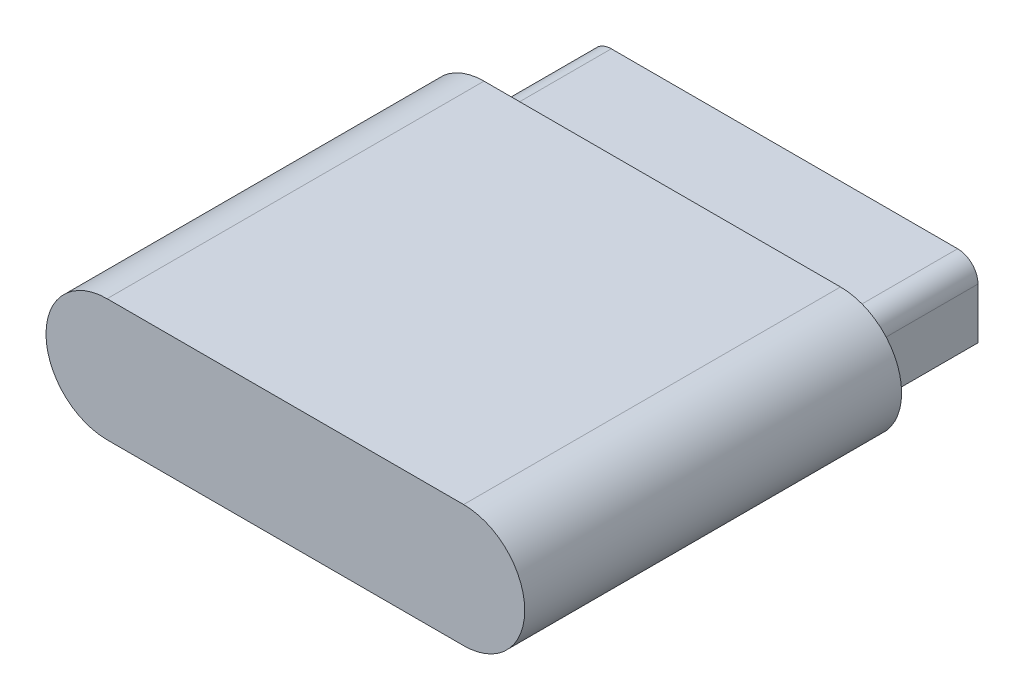
from build123d import *

# Parameters (mm, degrees)
BOSS_EXTRUDE2_DEPTH = 37
BOSS_EXTRUDE3_DEPTH = 12


with BuildPart() as part:
    # Sketch1 → Boss-Extrude2 (new body)
    with BuildSketch(Plane.XY):
        with BuildLine():
            Line((6, 0), (41, 0))
            ThreePointArc((41, 0), (47, 6), (41, 12))
            Line((41, 12), (6, 12))
            ThreePointArc((6, 12), (0, 6), (6, 0))
        make_face()
    extrude(amount=-BOSS_EXTRUDE2_DEPTH)

    # Sketch2 → Boss-Extrude3 (add)
    with BuildSketch(Plane(origin=(0, 0, -37), x_dir=(-1, 0, 0), z_dir=(0, 0, -1))):
        with BuildLine():
            Line((-42.5, 2), (-4.5, 2))
            Line((-4.5, 2), (-4.5, 7))
            ThreePointArc((-4.5, 7), (-5.085786438, 8.414213562), (-6.5, 9))
            Line((-6.5, 9), (-40.5, 9))
            ThreePointArc((-40.5, 9), (-41.914213562, 8.414213562), (-42.5, 7))
            Line((-42.5, 7), (-42.5, 2))
        make_face()
    extrude(amount=BOSS_EXTRUDE3_DEPTH)


solid = part.part
